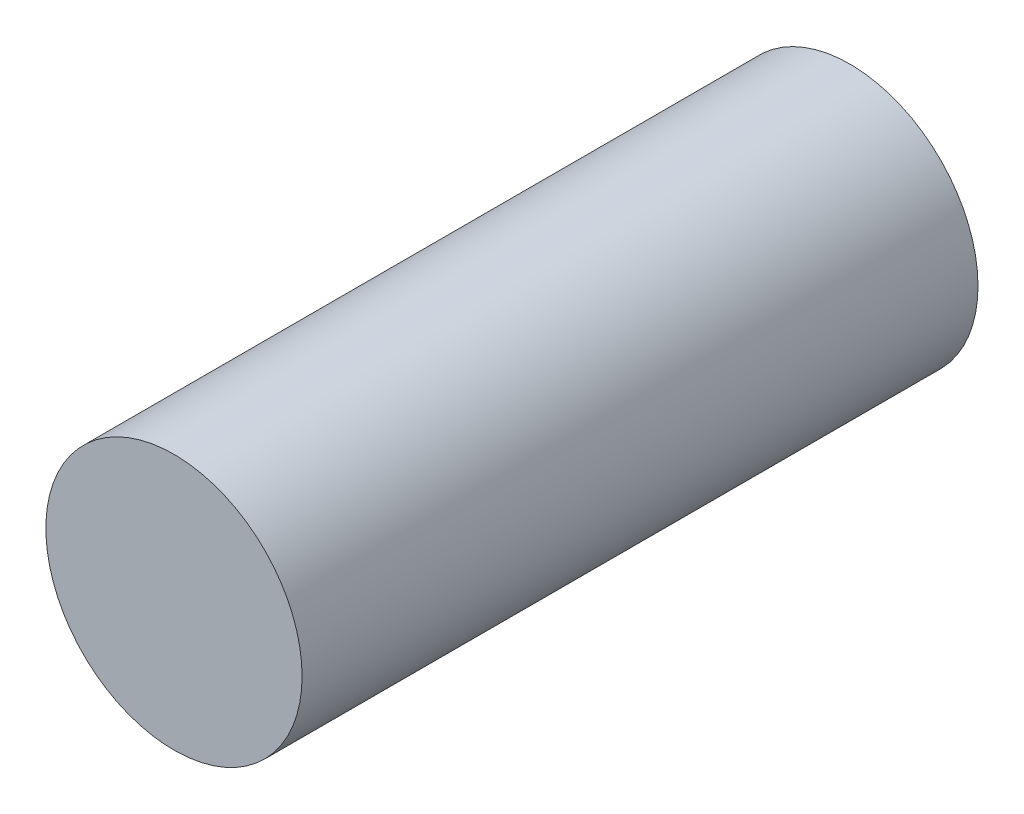
from build123d import *

# Parameters (mm, degrees)
SKETCH1_R           = 9.25
BOSS_EXTRUDE1_DEPTH = 48.8


with BuildPart() as part:
    # Sketch1 → Boss-Extrude1 (new body)
    with BuildSketch(Plane.XY):
        Circle(SKETCH1_R)
    extrude(amount=BOSS_EXTRUDE1_DEPTH)


solid = part.part
